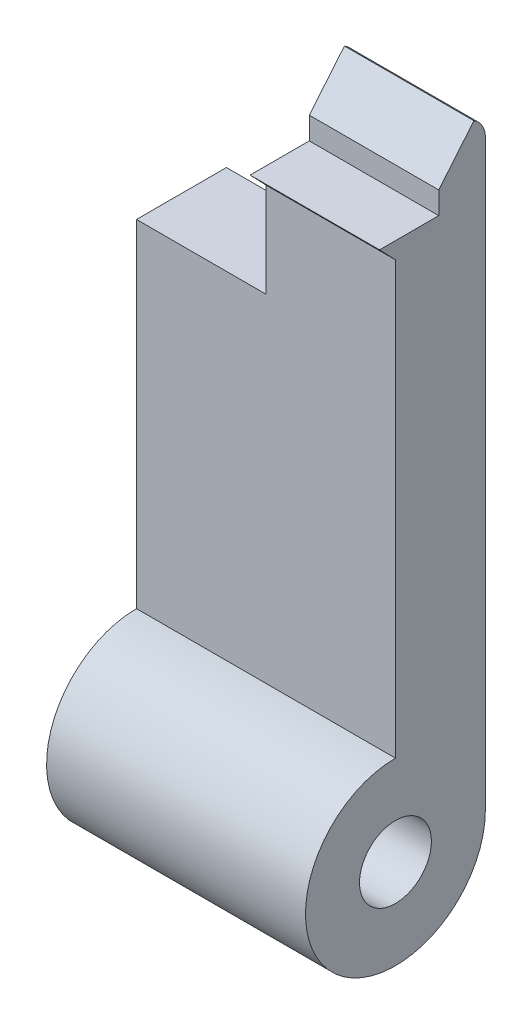
from build123d import *

# Parameters (mm, degrees)
SKETCH2_R           = 1.27
BOSS_EXTRUDE1_DEPTH = 9.144
SKETCH3_W           = 4.572
SKETCH3_H           = 7.508623498
CUT_EXTRUDE2_DEPTH  = 25.018241396


with BuildPart() as part:
    # Sketch2 → Boss-Extrude1 (new body)
    with BuildSketch(Plane(origin=(0, 0, 0), x_dir=(0, 0, -1), z_dir=(1, 0, 0))):
        with BuildLine():
            Line((0, 18.415), (0, 3.175))
            ThreePointArc((0, 3.175), (-2.24506403, -2.24506403), (3.175, 0))
            Line((3.175, 0), (3.175, 20.574))
            ThreePointArc((3.175, 20.574), (3.066754835, 20.981875221), (2.770508017, 21.282403148))
            Line((2.770508017, 21.282403148), (1.52985297, 19.787480142))
            Line((1.52985297, 19.787480142), (1.52985297, 19.000960284))
            Line((1.52985297, 19.000960284), (-0.561351088, 19.000960284))
            Line((-0.561351088, 19.000960284), (0, 18.415))
        make_face()
        Circle(SKETCH2_R, mode=Mode.SUBTRACT)
    extrude(amount=BOSS_EXTRUDE1_DEPTH)

    # Sketch3 → Cut-Extrude2 (cut, through all)
    with BuildSketch(Plane(origin=(0, 0, -3.175), x_dir=(-1, 0, 0), z_dir=(0, 0, -1))):
        with Locations((-2.286, 18.831880762)):
            Rectangle(SKETCH3_W, SKETCH3_H)
    extrude(amount=-CUT_EXTRUDE2_DEPTH, mode=Mode.SUBTRACT)


solid = part.part
